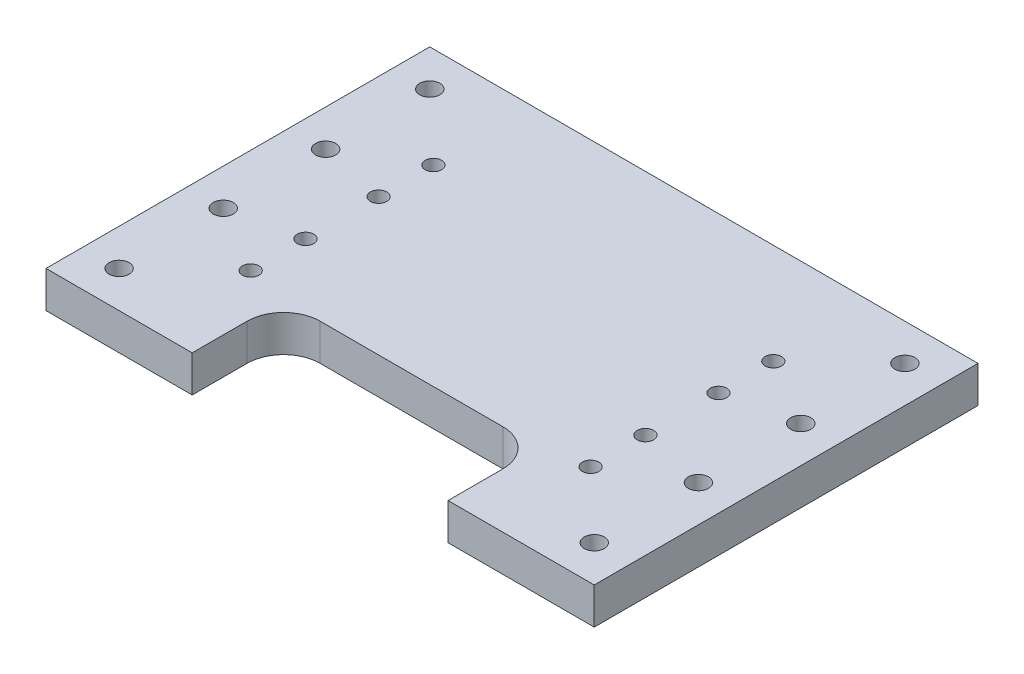
from build123d import *

# Parameters (mm, degrees)
SKETCH1_W                                           = 150
SKETCH1_H                                           = 105
BOSS_EXTRUDE1_DEPTH                                 = 5
CBORE_FOR_M4_HEX_SOCKET_HEAD_CAP_SCREW1_D           = 4.5
CBORE_FOR_M4_HEX_SOCKET_HEAD_CAP_SCREW1_CBORE_D     = 8
CBORE_FOR_M4_HEX_SOCKET_HEAD_CAP_SCREW1_CBORE_DEPTH = 4.5
F_5_5_5_5_DIAMETER_HOLE1_D                          = 5.5
SKETCH9_W                                           = 70
SKETCH9_H                                           = 25
CUT_EXTRUDE1_DEPTH                                  = 10
FILLET1_R                                           = 10


with BuildPart() as part:
    # Sketch1 → Boss-Extrude1 (new, symmetric)
    with BuildSketch(Plane(origin=(0, 0, 0), x_dir=(1, 0, 0), z_dir=(0, 1, 0))):
        Rectangle(SKETCH1_W, SKETCH1_H)
    extrude(amount=BOSS_EXTRUDE1_DEPTH, both=True)

    # CBORE for M4 Hex Socket Head Cap Screw1 (through all)
    with Locations(Plane(origin=(0, -5, 0), x_dir=(-1, 0, 0), z_dir=(0, -1, 0))):
        with Locations((-46.5, -25), (-46.5, -10), (-46.5, 10), (-46.5, 25), (46.5, -25), (46.5, -10), (46.5, 10), (46.5, 25)):
            CounterBoreHole(CBORE_FOR_M4_HEX_SOCKET_HEAD_CAP_SCREW1_D / 2, CBORE_FOR_M4_HEX_SOCKET_HEAD_CAP_SCREW1_CBORE_D / 2, CBORE_FOR_M4_HEX_SOCKET_HEAD_CAP_SCREW1_CBORE_DEPTH)

    # Ø5.5 (5.5) Diameter Hole1 (through all)
    with Locations(Plane(origin=(0, 5, 0), x_dir=(1, 0, 0), z_dir=(0, 1, 0))):
        with Locations((65, -42.5), (65, 42.5), (-65, 42.5), (-65, -42.5), (-65, -14), (65, -14), (-65, 14), (65, 14)):
            Hole(F_5_5_5_5_DIAMETER_HOLE1_D / 2)

    # Sketch9 → Cut-Extrude1 (cut)
    with BuildSketch(Plane(origin=(0, 5, 0), x_dir=(1, 0, 0), z_dir=(0, 1, 0))):
        with Locations((0, -40)):
            Rectangle(SKETCH9_W, SKETCH9_H)
    extrude(amount=-CUT_EXTRUDE1_DEPTH, mode=Mode.SUBTRACT)

    # Fillet1
    fillet1_edges = [part.edges().sort_by_distance(p)[0] for p in [
        (-35, 0, 27.5),
        (35, 0, 27.5),
    ]]
    fillet(fillet1_edges, radius=FILLET1_R)


solid = part.part
